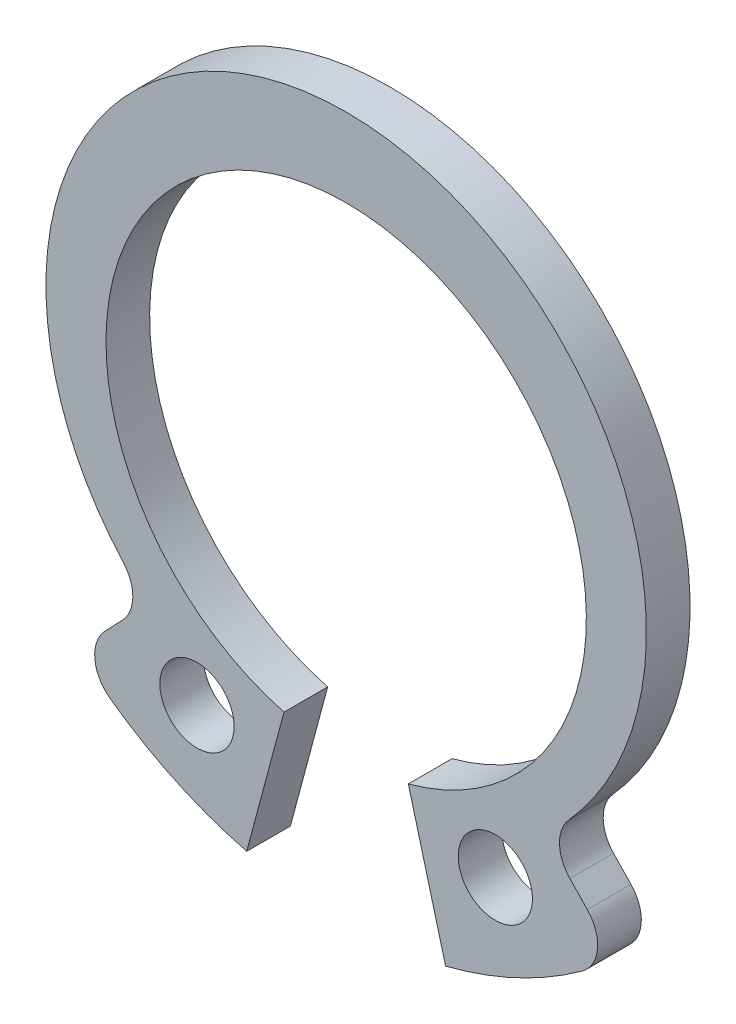
from build123d import *

# Parameters (mm, degrees)
ESQUISSE1_R          = 0.85
BASE_EXTRUSION_DEPTH = 1


with BuildPart() as part:
    # Esquisse1 → Base-Extrusion (new body)
    with BuildSketch(Plane.XY):
        with BuildLine():
            Line((5.122263167, -5.338312534), (5.522115291, -5.75502982))
            ThreePointArc((5.522115291, -5.75502982), (5.75540528, -6.419329253), (5.407821096, -7.031622639))
            ThreePointArc((5.407821096, -7.031622639), (3.912236534, -7.914074018), (2.277607597, -8.500147271))
            Line((2.277607597, -8.500147271), (1.423504748, -5.312592045))
            ThreePointArc((1.423504748, -5.312592045), (0, 5.5), (-1.423504748, -5.312592045))
            Line((-1.423504748, -5.312592045), (-2.277607597, -8.500147271))
            ThreePointArc((-2.277607597, -8.500147271), (-3.912236534, -7.914074018), (-5.407821096, -7.031622639))
            ThreePointArc((-5.407821096, -7.031622639), (-5.75540528, -6.419329253), (-5.522115291, -5.75502982))
            Line((-5.522115291, -5.75502982), (-5.122263167, -5.338312534))
            ThreePointArc((-5.122263167, -5.338312534), (-4.885686987, -4.762858971), (-5.104486664, -4.180414302))
            ThreePointArc((-5.104486664, -4.180414302), (0, 7.3), (5.104486664, -4.180414302))
            ThreePointArc((5.104486664, -4.180414302), (4.885686987, -4.762858971), (5.122263167, -5.338312534))
        make_face()
        with Locations((3.415662922, -6.172107342)):
            Circle(ESQUISSE1_R, mode=Mode.SUBTRACT)
        with Locations(Location((-3.415662922, -6.172107342, 0), (0, 0, 180))):
            Circle(ESQUISSE1_R, mode=Mode.SUBTRACT)
    extrude(amount=BASE_EXTRUSION_DEPTH)


solid = part.part
